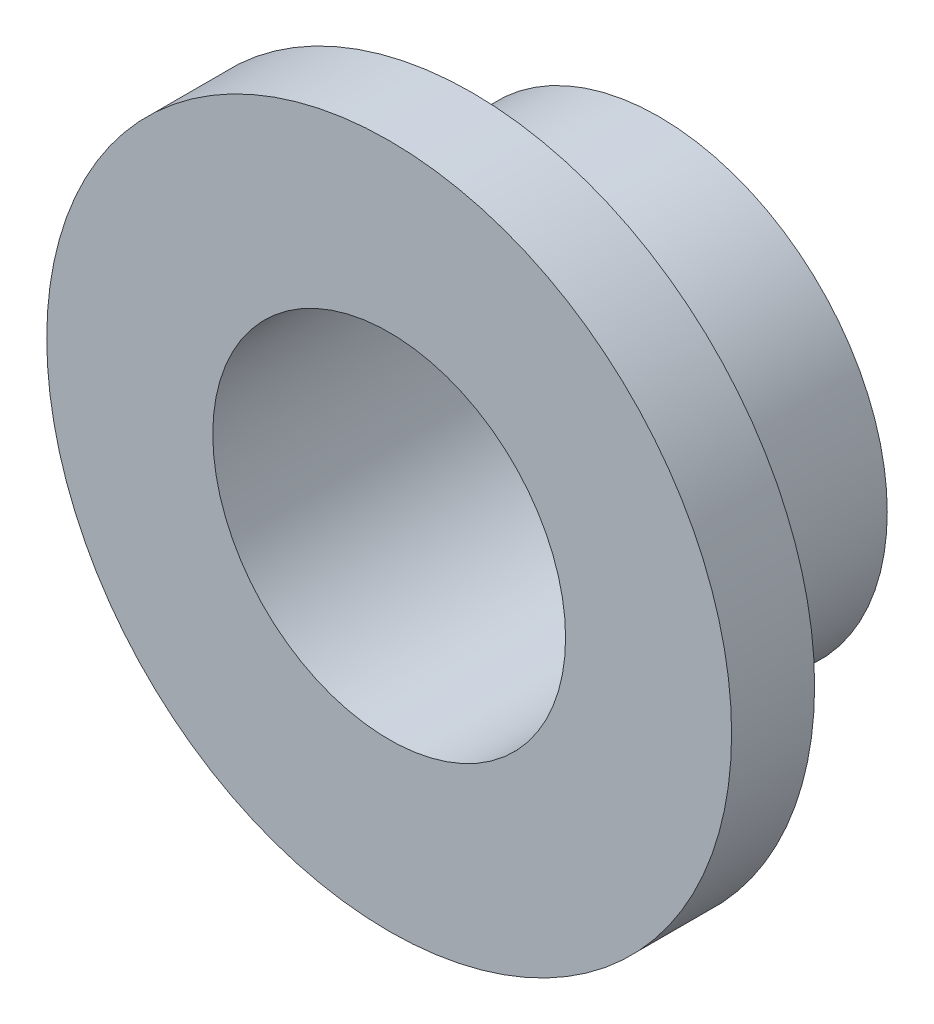
from build123d import *

# Parameters (mm, degrees)
CROQUIS1_R              = 8.25
CROQUIS1_R_2            = 4.25
SALIENTE_EXTRUIR1_DEPTH = 2
CROQUIS2_R              = 5.5
CROQUIS2_R_2            = 4.25
SALIENTE_EXTRUIR2_DEPTH = 4.5


with BuildPart() as part:
    # Croquis1 → Saliente-Extruir1 (new body)
    with BuildSketch(Plane.XY):
        Circle(CROQUIS1_R)
        Circle(CROQUIS1_R_2, mode=Mode.SUBTRACT)
    extrude(amount=-SALIENTE_EXTRUIR1_DEPTH)

    # Croquis2 → Saliente-Extruir2 (add)
    with BuildSketch(Plane(origin=(0, 0, -2), x_dir=(-1, 0, 0), z_dir=(0, 0, -1))):
        with Locations(Location((0, 0, 0), (0, 0, 180))):
            Circle(CROQUIS2_R)
        with Locations(Location((0, 0, 0), (0, 0, 180))):
            Circle(CROQUIS2_R_2, mode=Mode.SUBTRACT)
    extrude(amount=SALIENTE_EXTRUIR2_DEPTH)


solid = part.part
